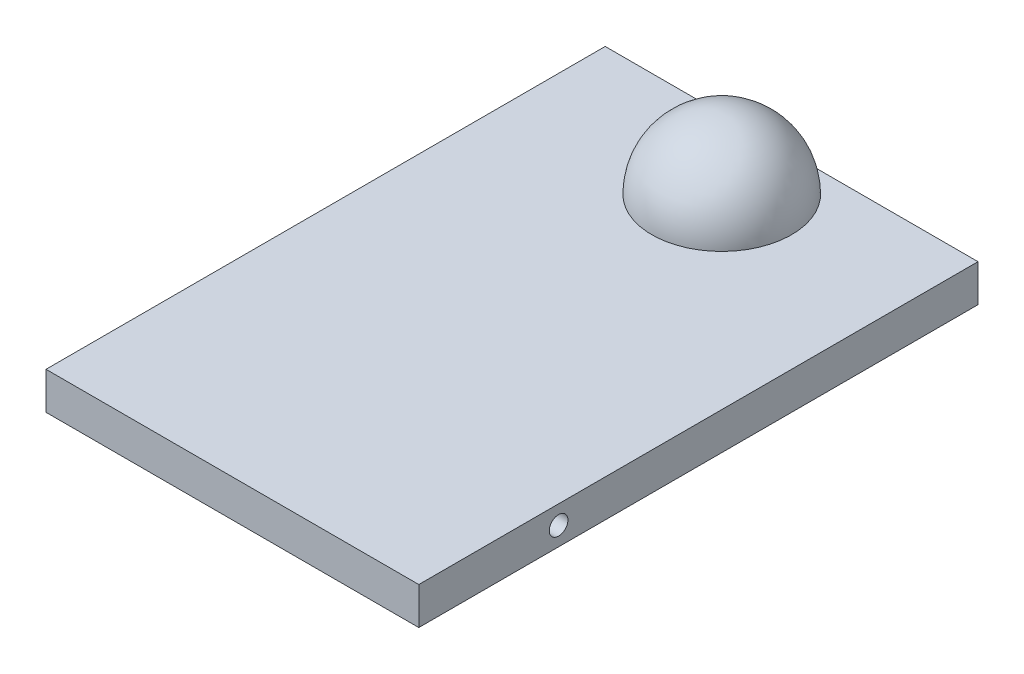
from build123d import *

# Parameters (mm, degrees)
SKETCH_1_W          = 100
SKETCH_1_H          = 150
EXTRUDE_1_DEPTH     = 10
REVOLVE_2_ANGLE     = 180
SKETCH_3_R          = 2.5
CUT_EXTRUDE_1_DEPTH = 129.263644498


with BuildPart() as part:
    # 草圖1 → 填料-伸長1 (new body)
    with BuildSketch(Plane(origin=(0, 0, 0), x_dir=(1, 0, 0), z_dir=(0, 1, 0))):
        Rectangle(SKETCH_1_W, SKETCH_1_H)
    extrude(amount=EXTRUDE_1_DEPTH)

    # 草圖2 → 旋轉2 (revolve)
    with BuildSketch(Plane(origin=(0, 10, 0), x_dir=(1, 0, 0), z_dir=(0, 1, 0))):
        with BuildLine():
            Line((0, 75), (0, 37.5))
            ThreePointArc((0, 37.5), (18.75, 56.25), (0, 75))
        make_face()
    revolve(axis=Axis((0, 10, -75), (0, 0, 1)), revolution_arc=REVOLVE_2_ANGLE)

    # 草圖3 → 除料-伸長1 (cut, through all)
    with BuildSketch(Plane.ZY.offset(50)):
        with Locations((37.5, 5)):
            Circle(SKETCH_3_R)
    extrude(amount=-CUT_EXTRUDE_1_DEPTH, mode=Mode.SUBTRACT)


solid = part.part
